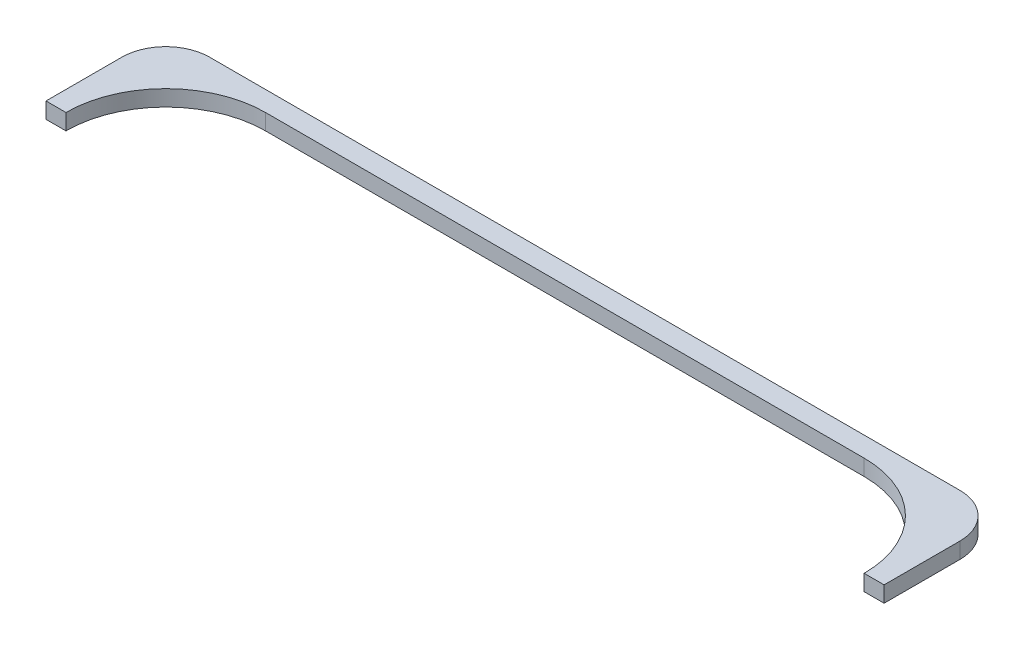
from build123d import *

# Parameters (mm, degrees)
SKETCH1_W          = 266.7
SKETCH1_H          = 38.1
BUMPER_BASE_DEPTH  = 5.08
CUT_EXTRUDE1_DEPTH = 135.79959718
FILLET1_R          = 13.97


with BuildPart() as part:
    # Sketch1 → Bumper-Base (new body)
    with BuildSketch(Plane(origin=(0, 0, 0), x_dir=(1, 0, 0), z_dir=(0, 1, 0))):
        Rectangle(SKETCH1_W, SKETCH1_H)
    extrude(amount=BUMPER_BASE_DEPTH)

    # Sketch2 → Cut-Extrude1 (cut, symmetric)
    with BuildSketch(Plane(origin=(0, 5.08, 0), x_dir=(1, 0, 0), z_dir=(0, 1, 0))):
        with BuildLine():
            Line((0, 12.7), (-95.25, 12.7))
            ThreePointArc((-95.25, 12.7), (-117.700640303, 3.400640303), (-127, -19.05))
            Line((-127, -19.05), (-95.25, -19.05))
            Line((-95.25, -19.05), (0, -19.05))
            Line((0, -19.05), (0, 12.7))
        make_face()
    cut_extrude1 = extrude(amount=CUT_EXTRUDE1_DEPTH, both=True, mode=Mode.SUBTRACT)

    # Mirror1: Cut-Extrude1 across plane
    add(cut_extrude1.mirror(Plane(origin=(0, 0, 0), x_dir=(0, 0, 1), z_dir=(1, 0, 0))), mode=Mode.SUBTRACT)

    # Fillet1
    fillet1_edges = [part.edges().sort_by_distance(p)[0] for p in [
        (-133.35, 2.54, -19.05),
        (133.35, 2.54, -19.05),
    ]]
    fillet(fillet1_edges, radius=FILLET1_R)


solid = part.part
